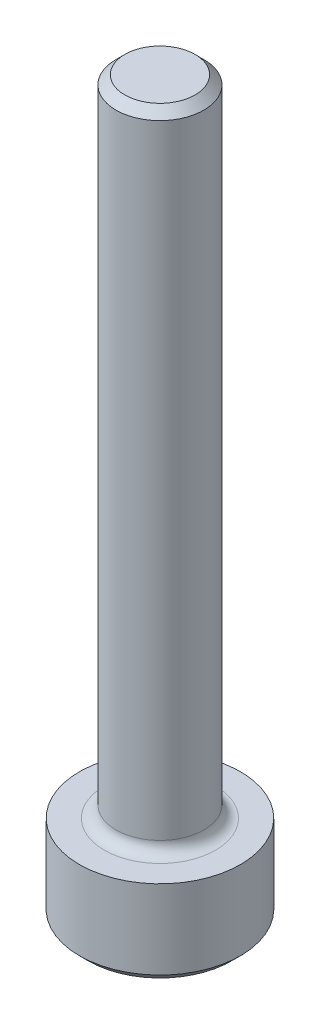
from build123d import *

# Parameters (mm, degrees)
SKETCH2_R           = 1.5
BOSS_EXTRUDE1_DEPTH = 22
SKETCH3_R           = 2.75
BOSS_EXTRUDE2_DEPTH = 3
FILLET1_R           = 0.4
CHAMFER1_SIZE       = 0.3
CUT_EXTRUDE1_DEPTH  = 2.5


with BuildPart() as part:
    # Sketch2 → Boss-Extrude1 (new body)
    with BuildSketch(Plane(origin=(0, 0, 0), x_dir=(1, 0, 0), z_dir=(0, 1, 0))):
        with Locations(Location((0, 0, 0), (0, 0, 270))):
            Circle(SKETCH2_R)
    extrude(amount=BOSS_EXTRUDE1_DEPTH)

    # Sketch3 → Boss-Extrude2 (add)
    with BuildSketch(Plane(origin=(0, 0, 0), x_dir=(1, 0, 0), z_dir=(0, 1, 0))):
        with Locations(Location((0, 0, 0), (0, 0, 270))):
            Circle(SKETCH3_R)
    extrude(amount=-BOSS_EXTRUDE2_DEPTH)

    # Fillet1
    fillet1_edges = [part.edges().sort_by_distance(p)[0] for p in [
        (0, 0, -1.5),
    ]]
    fillet(fillet1_edges, radius=FILLET1_R)

    # Chamfer1
    chamfer1_edges = [part.edges().sort_by_distance(p)[0] for p in [
        (0, 22, -1.5),
        (0, -3, -2.75),
    ]]
    chamfer(chamfer1_edges, length=CHAMFER1_SIZE)

    # Sketch4 → Cut-Extrude1 (cut)
    with BuildSketch(Plane.XZ.offset(3)):
        Polygon((0, 1.443375673), (-1.25, 0.721687836), (-1.25, -0.721687836), (0, -1.443375673), (1.25, -0.721687836), (1.25, 0.721687836), align=None)
    extrude(amount=-CUT_EXTRUDE1_DEPTH, mode=Mode.SUBTRACT)


solid = part.part
